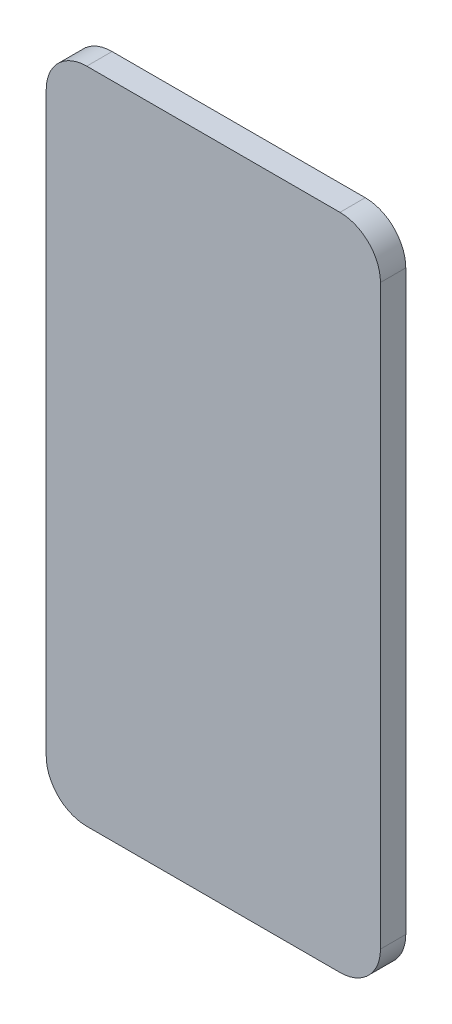
from build123d import *

# Parameters (mm, degrees)
BOSS_EXTRUDE1_DEPTH = 5


with BuildPart() as part:
    # Sketch1 → Boss-Extrude1 (new body)
    with BuildSketch(Plane.XY):
        with BuildLine():
            Line((25, 65), (-25, 65))
            ThreePointArc((-25, 65), (-30.656854249, 62.656854249), (-33, 57))
            Line((-33, 57), (-33, -57))
            ThreePointArc((-33, -57), (-30.656854249, -62.656854249), (-25, -65))
            Line((-25, -65), (25, -65))
            ThreePointArc((25, -65), (30.656854249, -62.656854249), (33, -57))
            Line((33, -57), (33, 57))
            ThreePointArc((33, 57), (30.656854249, 62.656854249), (25, 65))
        make_face()
    extrude(amount=BOSS_EXTRUDE1_DEPTH)


solid = part.part
